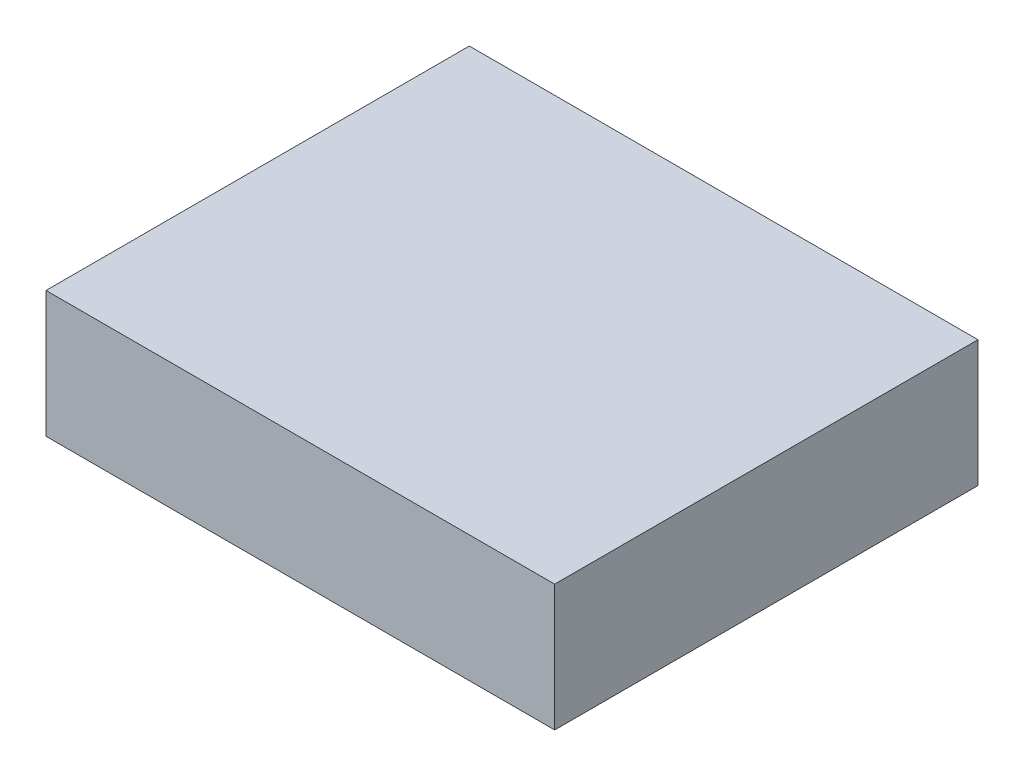
from build123d import *

# Parameters (mm, degrees)
SKETCH1_W           = 74.5
SKETCH1_H           = 62
BOSS_EXTRUDE1_DEPTH = 18.5


with BuildPart() as part:
    # Sketch1 → Boss-Extrude1 (new body)
    with BuildSketch(Plane(origin=(0, 0, 0), x_dir=(1, 0, 0), z_dir=(0, 1, 0))):
        with Locations((37.25, -31)):
            Rectangle(SKETCH1_W, SKETCH1_H)
    extrude(amount=BOSS_EXTRUDE1_DEPTH)


solid = part.part
